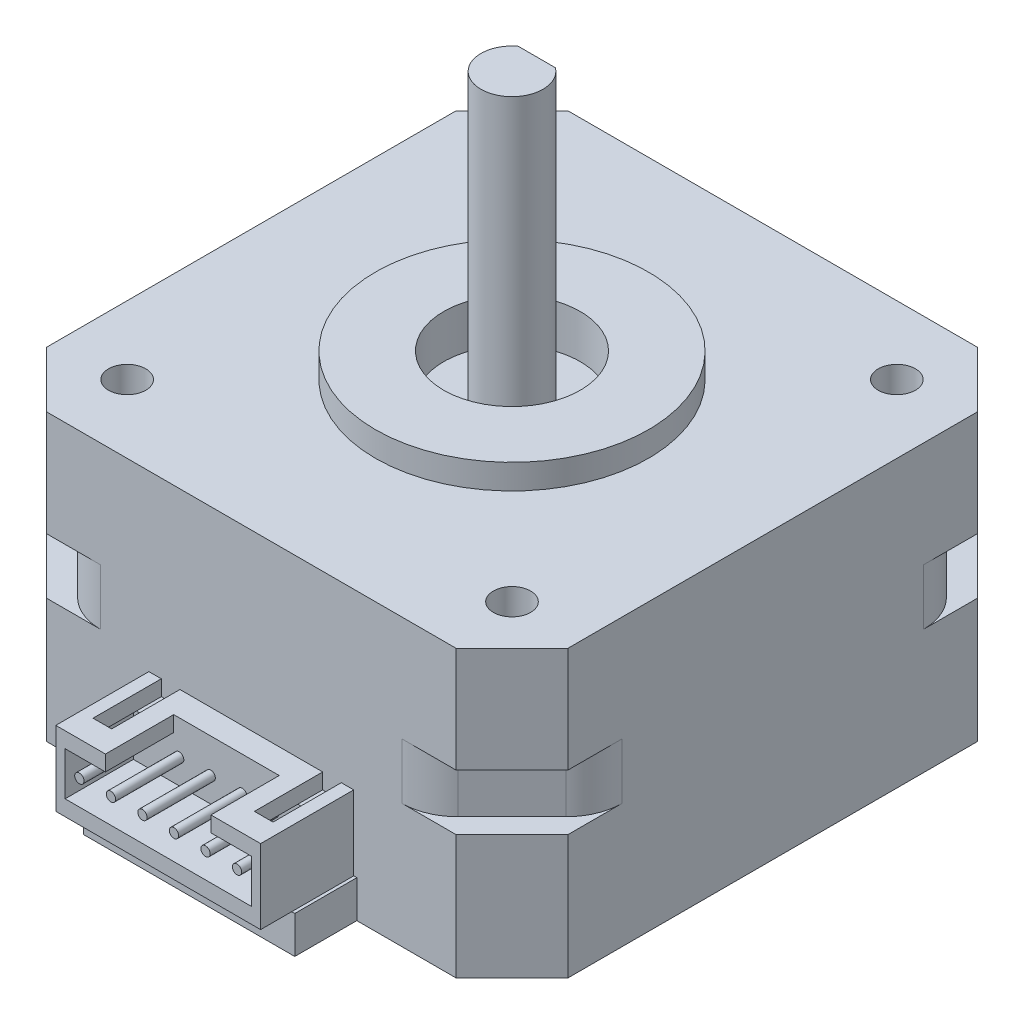
from build123d import *

# Parameters (mm, degrees)
BOSS_EXTRUDE1_DEPTH  = 10
BOSS_EXTRUDE3_DEPTH  = 4.5
BOSS_EXTRUDE4_DEPTH  = 8.5
SKETCH5_R            = 11
BOSS_EXTRUDE5_DEPTH  = 2
CUT_EXTRUDE1_REACH   = 39.563
SKETCH6_R            = 1.5
SKETCH7_R            = 5.5
CUT_EXTRUDE2_DEPTH   = 3.5
SKETCH8_R            = 2.5
BOSS_EXTRUDE6_DEPTH  = 3.5
BOSS_EXTRUDE7_DEPTH  = 19.5
SKETCH10_R           = 3.5
CUT_EXTRUDE3_DEPTH   = 3
SKETCH11_W           = 17
SKETCH11_H           = 3
BOSS_EXTRUDE8_DEPTH  = 5
SKETCH12_W           = 16.5
SKETCH12_H           = 6
BOSS_EXTRUDE9_DEPTH  = 7.5
SKETCH13_W           = 15
SKETCH13_H           = 3.5
CUT_EXTRUDE4_DEPTH   = 5.5
CUT_EXTRUDE5_REACH   = 52.135
SKETCH14_W           = 8.5
SKETCH14_H           = 5.5
SKETCH15_W           = 1.5
SKETCH15_H           = 5.5
CUT_EXTRUDE6_DEPTH   = 1.25
SKETCH16_R           = 0.375
BOSS_EXTRUDE10_DEPTH = 5.5


with BuildPart() as part:
    # Sketch1 → Boss-Extrude1 (new body)
    with BuildSketch(Plane(origin=(0, 0, 0), x_dir=(1, 0, 0), z_dir=(0, 1, 0))):
        Polygon((-21, 16.5), (-16.5, 21), (16.5, 21), (21, 16.5), (21, -16.5), (16.5, -21), (-16.5, -21), (-21, -16.5), align=None)
    extrude(amount=BOSS_EXTRUDE1_DEPTH)

    # Sketch2 → Boss-Extrude3 (add)
    with BuildSketch(Plane(origin=(0, 10, 0), x_dir=(1, 0, 0), z_dir=(0, 1, 0))):
        with BuildLine():
            Line((-15.318019485, 19.681980515), (-19.681980515, 15.318019485))
            ThreePointArc((-19.681980515, 15.318019485), (-20.657457896, 13.858114415), (-21, 12.136038969))
            Line((-21, 12.136038969), (-21, -12.136038969))
            ThreePointArc((-21, -12.136038969), (-20.657457896, -13.858114415), (-19.681980515, -15.318019485))
            Line((-19.681980515, -15.318019485), (-15.318019485, -19.681980515))
            ThreePointArc((-15.318019485, -19.681980515), (-13.858114415, -20.657457896), (-12.136038969, -21))
            Line((-12.136038969, -21), (12.136038969, -21))
            ThreePointArc((12.136038969, -21), (13.858114415, -20.657457896), (15.318019485, -19.681980515))
            Line((15.318019485, -19.681980515), (19.681980515, -15.318019485))
            ThreePointArc((19.681980515, -15.318019485), (20.657457896, -13.858114415), (21, -12.136038969))
            Line((21, -12.136038969), (21, 12.136038969))
            ThreePointArc((21, 12.136038969), (20.657457896, 13.858114415), (19.681980515, 15.318019485))
            Line((19.681980515, 15.318019485), (15.318019485, 19.681980515))
            ThreePointArc((15.318019485, 19.681980515), (13.858114415, 20.657457896), (12.136038969, 21))
            Line((12.136038969, 21), (-12.136038969, 21))
            ThreePointArc((-12.136038969, 21), (-13.858114415, 20.657457896), (-15.318019485, 19.681980515))
        make_face()
    extrude(amount=BOSS_EXTRUDE3_DEPTH)

    # Sketch4 → Boss-Extrude4 (add)
    with BuildSketch(Plane(origin=(0, 14.5, 0), x_dir=(1, 0, 0), z_dir=(0, 1, 0))):
        Polygon((-16.5, 21), (-21, 16.5), (-21, -16.5), (-16.5, -21), (16.5, -21), (21, -16.5), (21, 16.5), (16.5, 21), align=None)
    extrude(amount=BOSS_EXTRUDE4_DEPTH)

    # Sketch5 → Boss-Extrude5 (add)
    with BuildSketch(Plane(origin=(0, 23, 0), x_dir=(1, 0, 0), z_dir=(0, 1, 0))):
        with Locations(Location((0, 0, 0), (0, 0, 270))):
            Circle(SKETCH5_R)
    extrude(amount=BOSS_EXTRUDE5_DEPTH)

    # Sketch6 → Cut-Extrude1 (cut, up to next)
    with BuildSketch(Plane(origin=(0, 23, 0), x_dir=(1, 0, 0), z_dir=(0, 1, 0)), mode=Mode.PRIVATE) as cut_extrude1_sk1:
        with Locations(Location((-15.5, 15.5, 0), (0, 0, 270))):
            Circle(SKETCH6_R)
    cut_extrude1_tool1 = extrude(cut_extrude1_sk1.sketch, amount=-CUT_EXTRUDE1_REACH, mode=Mode.PRIVATE) & part.part
    # Sketch6 → Cut-Extrude1 (cut, up to next)
    with BuildSketch(Plane(origin=(0, 23, 0), x_dir=(1, 0, 0), z_dir=(0, 1, 0)), mode=Mode.PRIVATE) as cut_extrude1_sk2:
        with Locations(Location((15.5, 15.5, 0), (0, 0, 270))):
            Circle(SKETCH6_R)
    cut_extrude1_tool2 = extrude(cut_extrude1_sk2.sketch, amount=-CUT_EXTRUDE1_REACH, mode=Mode.PRIVATE) & part.part
    # Sketch6 → Cut-Extrude1 (cut, up to next)
    with BuildSketch(Plane(origin=(0, 23, 0), x_dir=(1, 0, 0), z_dir=(0, 1, 0)), mode=Mode.PRIVATE) as cut_extrude1_sk3:
        with Locations(Location((15.5, -15.5, 0), (0, 0, 270))):
            Circle(SKETCH6_R)
    cut_extrude1_tool3 = extrude(cut_extrude1_sk3.sketch, amount=-CUT_EXTRUDE1_REACH, mode=Mode.PRIVATE) & part.part
    # Sketch6 → Cut-Extrude1 (cut, up to next)
    with BuildSketch(Plane(origin=(0, 23, 0), x_dir=(1, 0, 0), z_dir=(0, 1, 0)), mode=Mode.PRIVATE) as cut_extrude1_sk4:
        with Locations(Location((-15.5, -15.5, 0), (0, 0, 270))):
            Circle(SKETCH6_R)
    cut_extrude1_tool4 = extrude(cut_extrude1_sk4.sketch, amount=-CUT_EXTRUDE1_REACH, mode=Mode.PRIVATE) & part.part
    add(cut_extrude1_tool1.solids().sort_by_distance((-15.5, 23, -15.5))[0], mode=Mode.SUBTRACT)
    add(cut_extrude1_tool2.solids().sort_by_distance((15.5, 23, -15.5))[0], mode=Mode.SUBTRACT)
    add(cut_extrude1_tool3.solids().sort_by_distance((15.5, 23, 15.5))[0], mode=Mode.SUBTRACT)
    add(cut_extrude1_tool4.solids().sort_by_distance((-15.5, 23, 15.5))[0], mode=Mode.SUBTRACT)

    # Sketch7 → Cut-Extrude2 (cut)
    with BuildSketch(Plane(origin=(0, 25, 0), x_dir=(1, 0, 0), z_dir=(0, 1, 0))):
        with Locations(Location((0, 0, 0), (0, 0, 270))):
            Circle(SKETCH7_R)
    extrude(amount=-CUT_EXTRUDE2_DEPTH, mode=Mode.SUBTRACT)

    # Sketch8 → Boss-Extrude6 (add)
    with BuildSketch(Plane(origin=(0, 21.5, 0), x_dir=(1, 0, 0), z_dir=(0, 1, 0))):
        with Locations(Location((0, 0, 0), (0, 0, 270))):
            Circle(SKETCH8_R)
    extrude(amount=BOSS_EXTRUDE6_DEPTH)

    # Sketch9 → Boss-Extrude7 (add)
    with BuildSketch(Plane(origin=(0, 25, 0), x_dir=(1, 0, 0), z_dir=(0, 1, 0))):
        with BuildLine():
            Line((-1.5, 2), (1.5, 2))
            ThreePointArc((1.5, 2), (0, -2.5), (-1.5, 2))
        make_face()
    extrude(amount=BOSS_EXTRUDE7_DEPTH)

    # Sketch10 → Cut-Extrude3 (cut)
    with BuildSketch(Plane.XZ):
        with Locations(Location((-15.5, 15.5, 0), (0, 0, 270))):
            Circle(SKETCH10_R)
        with Locations(Location((15.5, 15.5, 0), (0, 0, 270))):
            Circle(SKETCH10_R)
        with Locations(Location((15.5, -15.5, 0), (0, 0, 270))):
            Circle(SKETCH10_R)
        with Locations(Location((-15.5, -15.5, 0), (0, 0, 270))):
            Circle(SKETCH10_R)
    extrude(amount=-CUT_EXTRUDE3_DEPTH, mode=Mode.SUBTRACT)

    # Sketch11 → Boss-Extrude8 (add)
    with BuildSketch(Plane.XY.offset(21)):
        with Locations((0, 1.5)):
            Rectangle(SKETCH11_W, SKETCH11_H)
    extrude(amount=BOSS_EXTRUDE8_DEPTH)

    # Sketch12 → Boss-Extrude9 (add)
    with BuildSketch(Plane.XY.offset(21)):
        with Locations((0, 6)):
            Rectangle(SKETCH12_W, SKETCH12_H)
    extrude(amount=BOSS_EXTRUDE9_DEPTH)

    # Sketch13 → Cut-Extrude4 (cut)
    with BuildSketch(Plane.XY.offset(28.5)):
        with Locations((0, 6)):
            Rectangle(SKETCH13_W, SKETCH13_H)
    extrude(amount=-CUT_EXTRUDE4_DEPTH, mode=Mode.SUBTRACT)

    # Sketch14 → Cut-Extrude5 (cut, up to next)
    with BuildSketch(Plane(origin=(0, 9, 0), x_dir=(1, 0, 0), z_dir=(0, 1, 0)), mode=Mode.PRIVATE) as cut_extrude5_sk1:
        with Locations((0, -25.75)):
            Rectangle(SKETCH14_W, SKETCH14_H)
    cut_extrude5_tool1 = extrude(cut_extrude5_sk1.sketch, amount=-CUT_EXTRUDE5_REACH, mode=Mode.PRIVATE) & part.part
    add(cut_extrude5_tool1.solids().sort_by_distance((0, 9, 25.75))[0], mode=Mode.SUBTRACT)

    # Sketch15 → Cut-Extrude6 (cut)
    with BuildSketch(Plane(origin=(0, 9, 0), x_dir=(1, 0, 0), z_dir=(0, 1, 0))):
        with Locations((-6.5, -23.75)):
            Rectangle(SKETCH15_W, SKETCH15_H)
        with Locations((6.5, -23.75)):
            Rectangle(SKETCH15_W, SKETCH15_H)
    extrude(amount=-CUT_EXTRUDE6_DEPTH, mode=Mode.SUBTRACT)

    # Sketch16 → Boss-Extrude10 (add)
    with BuildSketch(Plane.XY.offset(23)):
        with Locations(Location((-1.27, 6.25, 0), (0, 0, 180))):
            Circle(SKETCH16_R)
        with Locations(Location((1.27, 6.25, 0), (0, 0, 180))):
            Circle(SKETCH16_R)
        with Locations(Location((-3.81, 6.25, 0), (0, 0, 180))):
            Circle(SKETCH16_R)
        with Locations(Location((-6.35, 6.25, 0), (0, 0, 180))):
            Circle(SKETCH16_R)
        with Locations(Location((3.81, 6.25, 0), (0, 0, 180))):
            Circle(SKETCH16_R)
        with Locations(Location((6.35, 6.25, 0), (0, 0, 180))):
            Circle(SKETCH16_R)
    extrude(amount=BOSS_EXTRUDE10_DEPTH)


solid = part.part
